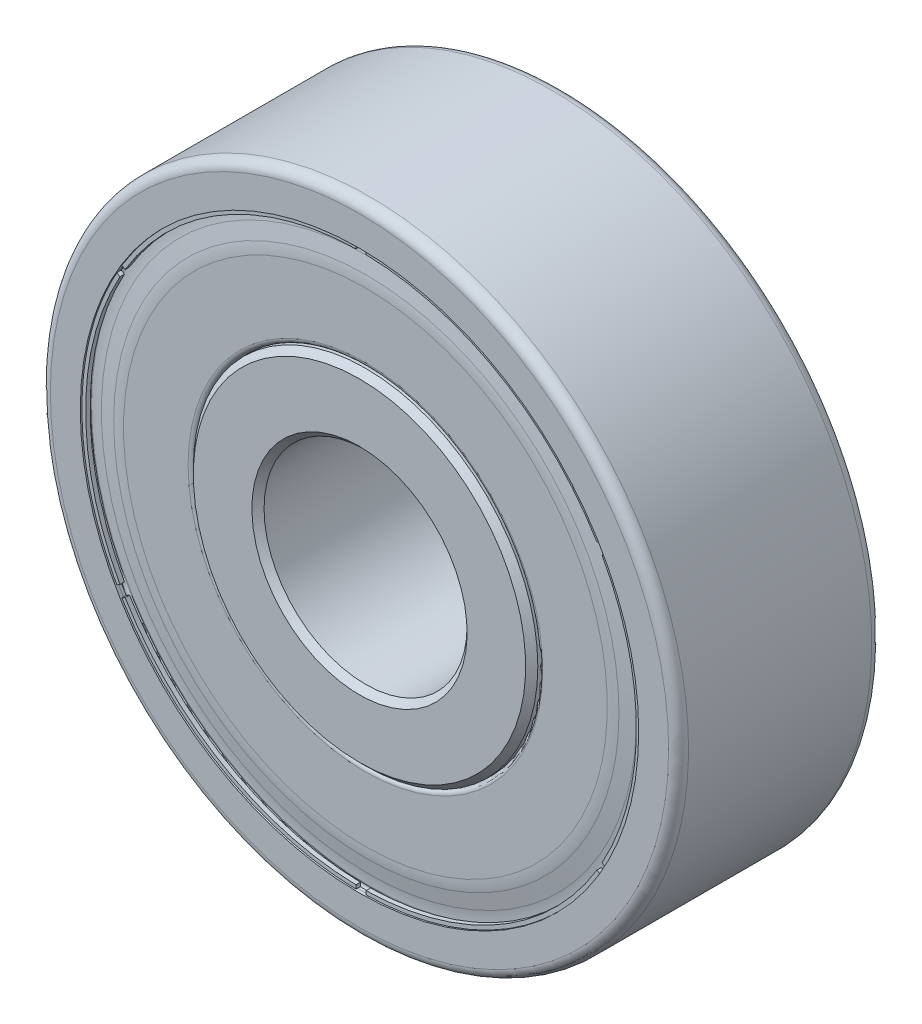
from build123d import *

# Parameters (mm, degrees)
CHAMFER1_SIZE      = 0.21
FILLET1_R          = 2.2
CIRPATTERN1_COUNT  = 6
CUT_EXTRUDE1_REACH = 19.037
CIRPATTERN2_COUNT  = 6


with BuildPart() as part:
    # Sketch3 → Revolve1 (revolve)
    with BuildSketch(Plane(origin=(0, 0, 0), x_dir=(0, 0, -1), z_dir=(1, 0, 0)), mode=Mode.PRIVATE) as revolve1_sk:
        with BuildLine():
            Line((-3.5, 3.5), (3.5, 3.5))
            Line((3.5, 3.5), (3.5, 5.9375))
            Line((3.5, 5.9375), (1.177175513, 5.9375))
            ThreePointArc((1.177175513, 5.9375), (0, 5.59375), (-1.177175513, 5.9375))
            Line((-1.177175513, 5.9375), (-3.5, 5.9375))
            Line((-3.5, 5.9375), (-3.5, 3.5))
        make_face()
        with BuildLine():
            Line((3.5, 9.625), (3.395, 9.625))
            ThreePointArc((3.395, 9.625), (3.235252255, 9.799334072), (3.047658643, 9.655388431))
            Line((3.047658643, 9.655388431), (2.945320504, 9.075))
            Line((2.945320504, 9.075), (1.763906797, 9.075))
            ThreePointArc((1.763906797, 9.075), (0, 9.96875), (-1.763906797, 9.075))
            Line((-1.763906797, 9.075), (-2.945320504, 9.075))
            Line((-2.945320504, 9.075), (-3.047658643, 9.655388431))
            ThreePointArc((-3.047658643, 9.655388431), (-3.235252255, 9.799334072), (-3.395, 9.625))
            Line((-3.395, 9.625), (-3.5, 9.625))
            Line((-3.5, 9.625), (-3.5, 10.65625))
            ThreePointArc((-3.5, 10.65625), (-3.399317956, 10.899317956), (-3.15625, 11))
            Line((-3.15625, 11), (3.15625, 11))
            ThreePointArc((3.15625, 11), (3.399317956, 10.899317956), (3.5, 10.65625))
            Line((3.5, 10.65625), (3.5, 9.625))
        make_face()
    revolve(revolve1_sk.sketch.rotate(Axis((0, 0, 3.5), (0, 0, -1)), 180), axis=Axis((0, 0, 3.5), (0, 0, -1)))

    # Chamfer1
    chamfer1_edges = [part.edges().sort_by_distance(p)[0] for p in [
        (0, 5.9375, 3.5),
        (0, 5.9375, -3.5),
        (0, 3.5, -3.5),
        (0, 3.5, 3.5),
    ]]
    chamfer(chamfer1_edges, length=CHAMFER1_SIZE)


with BuildPart() as body_2:
    # Sketch4 → Revolve2 (revolve)
    with BuildSketch(Plane(origin=(0, 0, 0), x_dir=(0, 0, -1), z_dir=(1, 0, 0)), mode=Mode.PRIVATE) as revolve2_sk:
        with BuildLine():
            Line((-3.395, 9.625), (-3.4475, 9.625))
            Line((-3.4475, 9.625), (-3.4475, 9.493))
            Line((-3.4475, 9.493), (-3.295, 9.493))
            Line((-3.295, 9.493), (-3.295, 9.625))
            ThreePointArc((-3.295, 9.625), (-3.22, 9.7), (-3.145, 9.625))
            Line((-3.145, 9.625), (-3.145, 9.405))
            Line((-3.145, 9.405), (-3.295, 8.525))
            Line((-3.295, 8.525), (-3.295, 6.1125))
            ThreePointArc((-3.295, 6.1125), (-3.243743687, 5.988756313), (-3.12, 5.9375))
            Line((-3.12, 5.9375), (-2.128333333, 5.9375))
            Line((-2.128333333, 5.9375), (-2.128333333, 6.0375))
            Line((-2.128333333, 6.0375), (-3.12, 6.0375))
            ThreePointArc((-3.12, 6.0375), (-3.173033009, 6.059466991), (-3.195, 6.1125))
            Line((-3.195, 6.1125), (-3.195, 8.525))
            Line((-3.195, 8.525), (-3.045, 9.405))
            Line((-3.045, 9.405), (-3.045, 9.625))
            ThreePointArc((-3.045, 9.625), (-3.22, 9.8), (-3.395, 9.625))
        make_face()
    revolve(revolve2_sk.sketch.rotate(Axis((0, 0, 3.5), (0, 0, -1)), 180), axis=Axis((0, 0, 3.5), (0, 0, -1)))

    # Fillet1
    fillet1_edges = [body_2.edges().sort_by_distance(p)[0] for p in [
        (0, 8.525, 3.295),
        (0, 9.405, 3.145),
    ]]
    fillet(fillet1_edges, radius=FILLET1_R)

    # Cut-Extrude1: up to this face of the body (flat: up to its plane)
    cut_extrude1_end = Plane(body_2.part.faces().sort_by_distance((0, 9.520223611, 3.295))[0])
    # Sketch6 → Cut-Extrude1 (cut, up to the picked face)
    with BuildSketch(Plane.XY.offset(3.4475), mode=Mode.PRIVATE) as cut_extrude1_sk1:
        with BuildLine():
            Line((-0.175, 9.623408959), (-0.175, 9.491386832))
            ThreePointArc((-0.175, 9.491386832), (0, 9.493), (0.175, 9.491386832))
            Line((0.175, 9.491386832), (0.175, 9.623408959))
            ThreePointArc((0.175, 9.623408959), (0, 9.625), (-0.175, 9.623408959))
        make_face()
    cut_extrude1_tool1 = split(extrude(cut_extrude1_sk1.sketch, amount=-CUT_EXTRUDE1_REACH, mode=Mode.PRIVATE), bisect_by=cut_extrude1_end, keep=Keep.BOTH, mode=Mode.PRIVATE)
    cut_extrude1 = cut_extrude1_tool1.solids().sort_by(Axis((0, 9.558466, 3.4475), (0, 0, -1)))[0]
    add(cut_extrude1, mode=Mode.SUBTRACT)

    # CirPattern2: Cut-Extrude1 ×6 about axis
    cirpattern2_axis = Axis((0, 0, 0), (0, 0, 1))
    for i in range(1, CIRPATTERN2_COUNT):
        add(cut_extrude1.rotate(cirpattern2_axis, i * 360 / CIRPATTERN2_COUNT), mode=Mode.SUBTRACT)


with BuildPart() as body_3:
    # Sketch5 → Revolve3 (revolve)
    with BuildSketch(Plane(origin=(0, 0, 0), x_dir=(0, 0, -1), z_dir=(1, 0, 0))):
        with BuildLine():
            Line((0, 9.96875), (0, 5.59375))
            ThreePointArc((0, 5.59375), (2.1875, 7.78125), (0, 9.96875))
        make_face()
    revolve(axis=Axis((0, 9.96875, 0), (0, -1, 0)))


with BuildPart() as cirpattern1_1:
    # CirPattern1: pattern copy
    add(body_3.part.rotate(Axis((0, 0, 0), (0, 0, 1)), 1 * 360 / CIRPATTERN1_COUNT))


with BuildPart() as cirpattern1_2:
    # CirPattern1: pattern copy
    add(body_3.part.rotate(Axis((0, 0, 0), (0, 0, 1)), 2 * 360 / CIRPATTERN1_COUNT))


with BuildPart() as cirpattern1_3:
    # CirPattern1: pattern copy
    add(body_3.part.rotate(Axis((0, 0, 0), (0, 0, 1)), 3 * 360 / CIRPATTERN1_COUNT))


with BuildPart() as cirpattern1_4:
    # CirPattern1: pattern copy
    add(body_3.part.rotate(Axis((0, 0, 0), (0, 0, 1)), 4 * 360 / CIRPATTERN1_COUNT))


with BuildPart() as cirpattern1_5:
    # CirPattern1: pattern copy
    add(body_3.part.rotate(Axis((0, 0, 0), (0, 0, 1)), 5 * 360 / CIRPATTERN1_COUNT))


with BuildPart() as body_9:
    # Mirror2: mirrored copy
    add(body_2.part.mirror(Plane.XY))


solid = Compound([part.part, body_2.part, body_3.part, cirpattern1_1.part, cirpattern1_2.part, cirpattern1_3.part, cirpattern1_4.part, cirpattern1_5.part, body_9.part])
